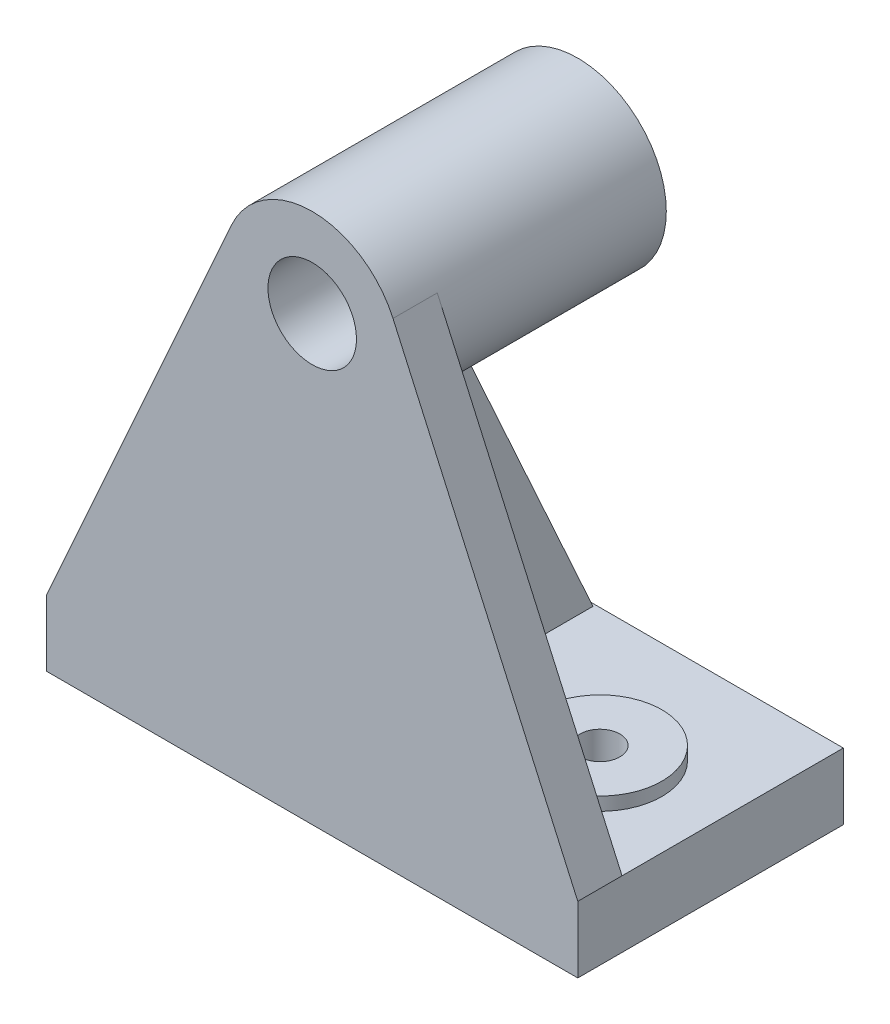
from build123d import *

# Parameters (mm, degrees)
SKETCH1_W           = 120
SKETCH1_H           = 60
SKETCH1_R           = 4.5
BOSS_EXTRUDE1_DEPTH = 15
SKETCH2_R           = 20
SKETCH2_R_2         = 10
BOSS_EXTRUDE2_DEPTH = 60
BOSS_EXTRUDE3_DEPTH = 10
BOSS_EXTRUDE4_START = 3
SKETCH11_R          = 14
SKETCH11_R_2        = 4.5
BOSS_EXTRUDE4_DEPTH = 3
RIB1_REACH          = 126.599
SKETCH13_WALL_W     = 322.54976404
SKETCH13_WALL_H     = 8
FILLET1_R           = 2


with BuildPart() as part:
    # Sketch1 → Boss-Extrude1 (new body)
    with BuildSketch(Plane(origin=(0, 0, 0), x_dir=(1, 0, 0), z_dir=(0, 1, 0))):
        Rectangle(SKETCH1_W, SKETCH1_H)
        with Locations(Location((-35, 0, 0), (0, 0, 270))):
            Circle(SKETCH1_R, mode=Mode.SUBTRACT)
        with Locations(Location((35, 0, 0), (0, 0, 270))):
            Circle(SKETCH1_R, mode=Mode.SUBTRACT)
    extrude(amount=-BOSS_EXTRUDE1_DEPTH)



with BuildPart() as body_2:
    # Sketch2 → Boss-Extrude2 (new body)
    with BuildSketch(Plane.XY.offset(30)):
        with Locations((0, 85)):
            Circle(SKETCH2_R)
        with Locations((0, 85)):
            Circle(SKETCH2_R_2, mode=Mode.SUBTRACT)
    extrude(amount=-BOSS_EXTRUDE2_DEPTH)


with BuildPart() as part_1:
    add(part.part)

    add(body_2.part)  # Boss-Extrude3 merges body 2
    # Sketch3 → Boss-Extrude3 (add)
    with BuildSketch(Plane.XY.offset(30)):
        with BuildLine():
            Line((-60, 0), (-18.251723952, 93.177687496))
            ThreePointArc((-18.251723952, 93.177687496), (0, 65), (18.251723952, 93.177687496))
            Line((18.251723952, 93.177687496), (60, 0))
            Line((60, 0), (-60, 0))
        make_face()
    extrude(amount=-BOSS_EXTRUDE3_DEPTH)

    # Sketch11 → Boss-Extrude4 (add)
    # profile 1 of 2: a face of its own
    with BuildSketch(Plane(origin=(0, 0, 0), x_dir=(1, 0, 0), z_dir=(0, 1, 0)).offset(BOSS_EXTRUDE4_START)):
        with Locations(Location((-35, 0, 0), (0, 0, 270))):
            Circle(SKETCH11_R)
        with Locations(Location((-35, 0, 0), (0, 0, 270))):
            Circle(SKETCH11_R_2, mode=Mode.SUBTRACT)
    # profile 2 of 2: a face of its own
    with BuildSketch(Plane(origin=(0, 0, 0), x_dir=(1, 0, 0), z_dir=(0, 1, 0)).offset(BOSS_EXTRUDE4_START)):
        with Locations(Location((35, 0, 0), (0, 0, 270))):
            Circle(SKETCH11_R)
        with Locations(Location((35, 0, 0), (0, 0, 270))):
            Circle(SKETCH11_R_2, mode=Mode.SUBTRACT)
    extrude(amount=-BOSS_EXTRUDE4_DEPTH)

    # Sketch13 wall → Rib1 (add, up to next)
    with BuildSketch(Plane(origin=(0, 32.5, -14.713701713), x_dir=(0, 0.910988719631, 0.41243127028), z_dir=(0, -0.41243127028, 0.910988719631)), mode=Mode.PRIVATE) as rib1_sk1:
        Rectangle(SKETCH13_WALL_W, SKETCH13_WALL_H)
    rib1_tool1 = extrude(rib1_sk1.sketch, amount=RIB1_REACH, mode=Mode.PRIVATE) - part_1.part
    add(rib1_tool1.solids().sort_by_distance((0, 32.5, -14.713701713))[0])

    # Fillet1
    fillet1_edges = [part_1.edges().sort_by_distance(p)[0] for p in [
        (0, 65, -1e-09),
    ]]
    fillet(fillet1_edges, radius=FILLET1_R)


solid = part_1.part
